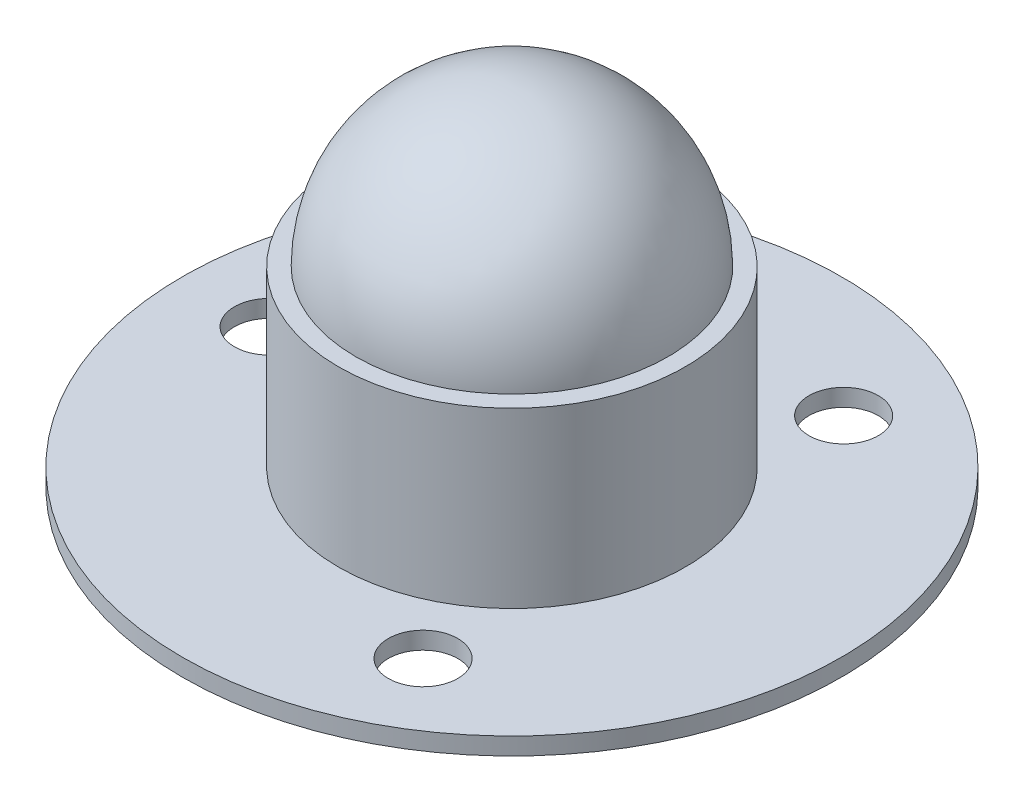
from build123d import *
from build123d.topology import SkipClean

# Parameters (mm, degrees)
SKETCH1_R           = 19
SKETCH1_R_2         = 2
BOSS_EXTRUDE1_DEPTH = 0.5
SKETCH2_R           = 10
BOSS_EXTRUDE2_DEPTH = 10


with BuildPart() as part:
    # Sketch1 → Boss-Extrude1 (new, symmetric)
    with BuildSketch(Plane(origin=(0, 0, 0), x_dir=(1, 0, 0), z_dir=(0, 1, 0))):
        with Locations(Location((0, 0, 0), (0, 0, 270))):
            Circle(SKETCH1_R)
        with Locations(Location((-14, 0, 0), (0, 0, 270))):
            Circle(SKETCH1_R_2, mode=Mode.SUBTRACT)
        with Locations(Location((7, 12.124355653, 0), (0, 0, 270))):
            Circle(SKETCH1_R_2, mode=Mode.SUBTRACT)
        with Locations(Location((7, -12.124355653, 0), (0, 0, 270))):
            Circle(SKETCH1_R_2, mode=Mode.SUBTRACT)
    extrude(amount=BOSS_EXTRUDE1_DEPTH, both=True)

    # Sketch2 → Boss-Extrude2 (add)
    with BuildSketch(Plane(origin=(0, 0.5, 0), x_dir=(1, 0, 0), z_dir=(0, 1, 0))):
        with Locations(Location((0, 0, 0), (0, 0, 270))):
            Circle(SKETCH2_R)
    extrude(amount=BOSS_EXTRUDE2_DEPTH)

    # Sketch3 → Revolve1 (revolve)
    with SkipClean():  # the faces are left unmerged after this step: merging them gives an invalid solid
        with BuildSketch(Plane(origin=(0, 10.5, 0), x_dir=(1, 0, 0), z_dir=(0, 1, 0))):
            with BuildLine():
                ThreePointArc((9, 0), (6.363961031, 6.363961031), (0, 9))
                Line((0, 9), (0, -9))
                ThreePointArc((0, -9), (6.363961031, -6.363961031), (9, 0))
            make_face()
            with BuildLine():
                Line((0, -9), (0, 9))
                ThreePointArc((0, 9), (-9, 0), (0, -9))
            make_face()
        revolve(axis=Axis((0, 10.5, -9), (0, 0, 1)))


solid = part.part
